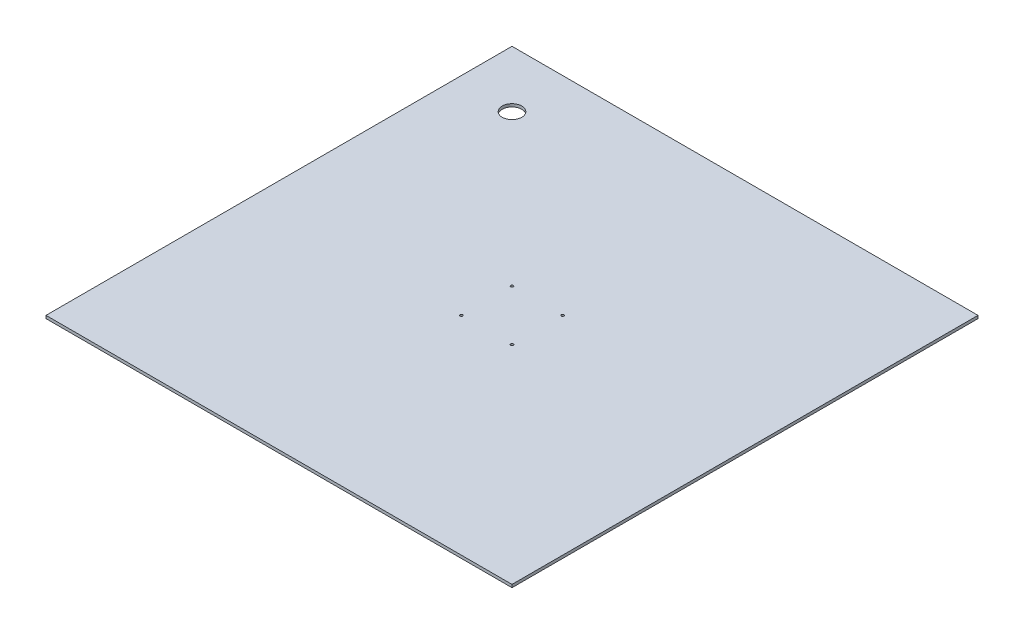
from build123d import *

# Parameters (mm, degrees)
SKETCH1_W           = 514.35
SKETCH1_H           = 514.35
SKETCH1_R           = 10.795
BOSS_EXTRUDE1_DEPTH = 3.175
SKETCH2_R           = 1.45
CUT_EXTRUDE1_DEPTH  = 364.714231059


with BuildPart() as part:
    # Sketch1 → Boss-Extrude1 (new body)
    with BuildSketch(Plane(origin=(0, 0, 0), x_dir=(1, 0, 0), z_dir=(0, 1, 0))):
        Rectangle(SKETCH1_W, SKETCH1_H)
        with Locations(Location((-194.722397765, 194.722397765, 0), (0, 0, 270))):
            Circle(SKETCH1_R, mode=Mode.SUBTRACT)
    extrude(amount=BOSS_EXTRUDE1_DEPTH)

    # Sketch2 → Cut-Extrude1 (cut, through all)
    with BuildSketch(Plane(origin=(0, 3.175, 0), x_dir=(1, 0, 0), z_dir=(0, 1, 0))):
        with Locations(Location((-27.94, 27.94, 0), (0, 0, 270))):
            Circle(SKETCH2_R)
        with Locations(Location((27.94, 27.94, 0), (0, 0, 90))):
            Circle(SKETCH2_R)
        with Locations(Location((27.94, -27.94, 0), (0, 0, 270))):
            Circle(SKETCH2_R)
        with Locations(Location((-27.94, -27.94, 0), (0, 0, 90))):
            Circle(SKETCH2_R)
    extrude(amount=-CUT_EXTRUDE1_DEPTH, mode=Mode.SUBTRACT)


solid = part.part
